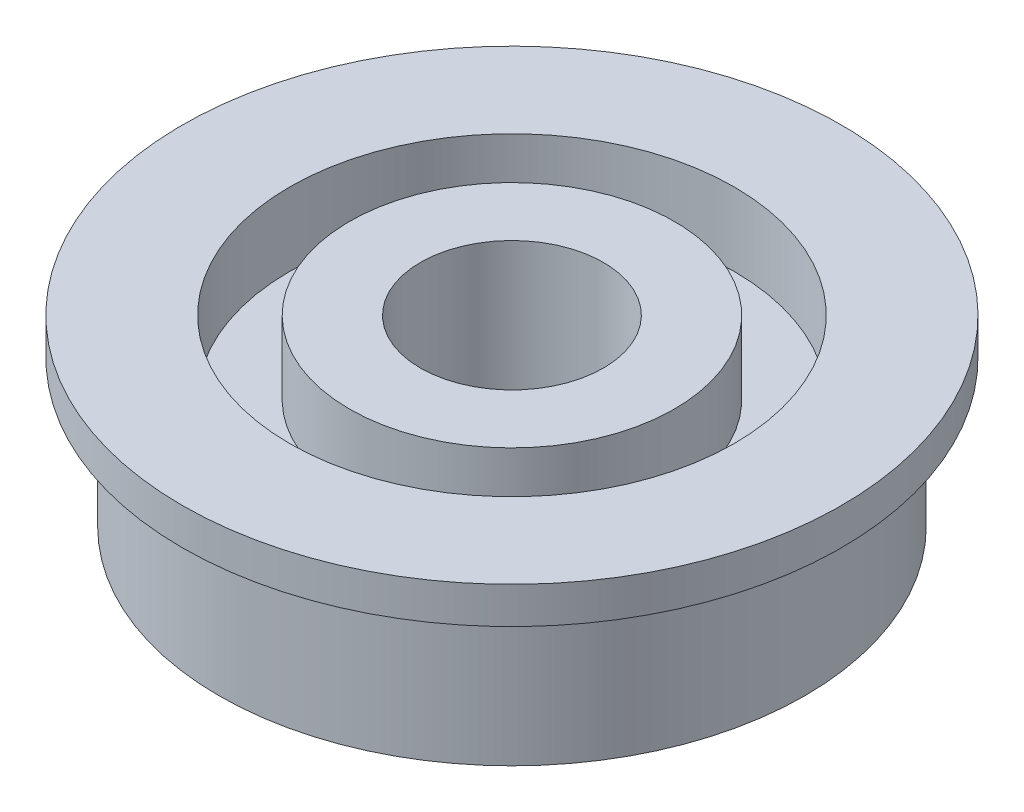
from build123d import *

# Parameters (mm, degrees)
SKETCH1_R           = 8
SKETCH1_R_2         = 2.5
BOSS_EXTRUDE1_DEPTH = 4
SKETCH2_R           = 9
SKETCH2_R_2         = 2.5
BOSS_EXTRUDE2_DEPTH = 1
SKETCH3_R           = 6.084261399
SKETCH3_R_2         = 4.35508582
CUT_EXTRUDE1_DEPTH  = 1
SKETCH4_R           = 6.070062278
SKETCH4_R_2         = 4.43730614
CUT_EXTRUDE2_DEPTH  = 2


with BuildPart() as part:
    # Sketch1 → Boss-Extrude1 (new body)
    with BuildSketch(Plane(origin=(0, 0, 0), x_dir=(1, 0, 0), z_dir=(0, 1, 0))):
        with Locations(Location((0, 0, 0), (0, 0, 270))):
            Circle(SKETCH1_R)
        with Locations(Location((0, 0, 0), (0, 0, 270))):
            Circle(SKETCH1_R_2, mode=Mode.SUBTRACT)
    extrude(amount=BOSS_EXTRUDE1_DEPTH)

    # Sketch2 → Boss-Extrude2 (add)
    with BuildSketch(Plane(origin=(0, 4, 0), x_dir=(1, 0, 0), z_dir=(0, 1, 0))):
        with Locations(Location((0, 0, 0), (0, 0, 270))):
            Circle(SKETCH2_R)
        with Locations(Location((0, 0, 0), (0, 0, 270))):
            Circle(SKETCH2_R_2, mode=Mode.SUBTRACT)
    extrude(amount=BOSS_EXTRUDE2_DEPTH)

    # Sketch3 → Cut-Extrude1 (cut)
    with BuildSketch(Plane.XZ):
        with Locations(Location((0, 0, 0), (0, 0, 270))):
            Circle(SKETCH3_R)
        with Locations(Location((0, 0, 0), (0, 0, 270))):
            Circle(SKETCH3_R_2, mode=Mode.SUBTRACT)
    extrude(amount=-CUT_EXTRUDE1_DEPTH, mode=Mode.SUBTRACT)

    # Sketch4 → Cut-Extrude2 (cut)
    with BuildSketch(Plane(origin=(0, 5, 0), x_dir=(1, 0, 0), z_dir=(0, 1, 0))):
        with Locations(Location((0, 0, 0), (0, 0, 270))):
            Circle(SKETCH4_R)
        with Locations(Location((0, 0, 0), (0, 0, 270))):
            Circle(SKETCH4_R_2, mode=Mode.SUBTRACT)
    extrude(amount=-CUT_EXTRUDE2_DEPTH, mode=Mode.SUBTRACT)


solid = part.part
